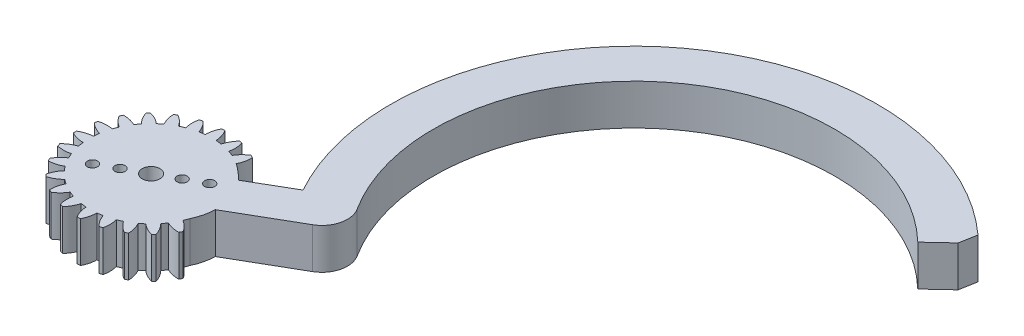
from build123d import *

# Parameters (mm, degrees)
CROQUIS3_R              = 1.75
SALIENTE_EXTRUIR2_DEPTH = 8
CROQUIS4_R              = 1
CORTAR_EXTRUIR1_DEPTH   = 8
CORTAR_EXTRUIR2_DEPTH   = 4


with BuildPart() as part:
    # Croquis3 → Saliente-Extruir2 (new body)
    with BuildSketch(Plane(origin=(0, 0, 0), x_dir=(1, 0, 0), z_dir=(0, 1, 0))):
        with BuildLine():
            Line((87.111019212, 63.804032696), (91.223264764, 67.638763711))
            Line((91.223264764, 67.638763711), (91.815621149, 70.950831381))
            ThreePointArc((91.815621149, 70.950831381), (29.87732987, 72.940785596), (17.735388738, 12.171672472))
            Line((17.735388738, 12.171672472), (9.721894551, 7.515983209))
            ThreePointArc((9.721894551, 7.515983209), (9.056743368, 8.17044576), (8.33477019, 8.76163275))
            ThreePointArc((8.33477019, 8.76163275), (7.527702463, 9.464052948), (6.66170644, 10.092386728))
            ThreePointArc((6.66170644, 10.092386728), (7.120443737, 11.359558341), (7.251125308, 12.700858505))
            ThreePointArc((7.251125308, 12.700858505), (6.978446869, 12.852700273), (6.702590326, 12.9986887))
            ThreePointArc((6.702590326, 12.9986887), (5.648855639, 12.158565486), (4.835962342, 11.083684892))
            ThreePointArc((4.835962342, 11.083684892), (4.333654022, 11.289554703), (3.822612402, 11.472673489))
            ThreePointArc((3.822612402, 11.472673489), (3.937750458, 12.815397225), (3.716825134, 14.144816574))
            ThreePointArc((3.716825134, 14.144816574), (3.414138446, 14.220910086), (3.109896902, 14.290527151))
            ThreePointArc((3.109896902, 14.290527151), (2.349191787, 13.184063868), (1.802512181, 11.957656643))
            ThreePointArc((1.802512181, 11.957656643), (1.264036574, 12.02650465), (0.723013645, 12.071116511))
            ThreePointArc((0.723013645, 12.071116511), (0.486705992, 13.397887968), (-0.07077053, 14.624828769))
            ThreePointArc((-0.07077053, 14.624828769), (-0.382837869, 14.619988378), (-0.694730857, 14.608489793))
            ThreePointArc((-0.694730857, 14.608489793), (-1.187230257, 13.354054404), (-1.353776206, 12.016733855))
            ThreePointArc((-1.353776206, 12.016733855), (-1.891722877, 11.943868181), (-2.425857296, 11.846932892))
            ThreePointArc((-2.425857296, 11.846932892), (-2.997506682, 13.067334786), (-3.8535433, 14.108183052))
            ThreePointArc((-3.8535433, 14.108183052), (-4.153724416, 14.022738622), (-4.452013856, 13.930907997))
            ThreePointArc((-4.452013856, 13.930907997), (-4.603059976, 12.591748233), (-4.417806982, 11.256890513))
            ThreePointArc((-4.417806982, 11.256890513), (-4.918564541, 11.047276833), (-5.409410071, 10.815400374))
            ThreePointArc((-5.409410071, 10.815400374), (-6.27744423, 11.846264333), (-7.373703462, 12.630087975))
            ThreePointArc((-7.373703462, 12.630087975), (-7.641541509, 12.469862404), (-7.905899467, 12.303957843))
            ThreePointArc((-7.905899467, 12.303957843), (-7.705198765, 10.971335229), (-7.180771513, 9.729908686))
            ThreePointArc((-7.180771513, 9.729908686), (-7.610214159, 9.397831825), (-8.02432049, 9.046816193))
            ThreePointArc((-8.02432049, 9.046816193), (-9.129584328, 9.817890543), (-10.391357918, 10.291273275))
            ThreePointArc((-10.391357918, 10.291273275), (-10.608600176, 10.06718567), (-10.821011096, 9.838513296))
            ThreePointArc((-10.821011096, 9.838513296), (-10.282240991, 8.60324386), (-9.454378332, 7.539849661))
            ThreePointArc((-9.454378332, 7.539849661), (-9.783240259, 7.10794011), (-10.092386728, 6.66170644))
            ThreePointArc((-10.092386728, 6.66170644), (-11.359558341, 7.120443737), (-12.700858505, 7.251125308))
            ThreePointArc((-12.700858505, 7.251125308), (-12.852700273, 6.978446869), (-12.9986887, 6.702590326))
            ThreePointArc((-12.9986887, 6.702590326), (-12.158565486, 5.648855639), (-11.083684892, 4.835962342))
            ThreePointArc((-11.083684892, 4.835962342), (-11.289554703, 4.333654022), (-11.472673489, 3.822612402))
            ThreePointArc((-11.472673489, 3.822612402), (-12.815397225, 3.937750458), (-14.144816574, 3.716825134))
            ThreePointArc((-14.144816574, 3.716825134), (-14.220910086, 3.414138446), (-14.290527151, 3.109896902))
            ThreePointArc((-14.290527151, 3.109896902), (-13.206303836, 2.309507242), (-11.957656643, 1.802512181))
            ThreePointArc((-11.957656643, 1.802512181), (-12.02650465, 1.264036574), (-12.071116511, 0.723013645))
            ThreePointArc((-12.071116511, 0.723013645), (-13.397887968, 0.486705992), (-14.624828769, -0.07077053))
            ThreePointArc((-14.624828769, -0.07077053), (-14.619988378, -0.382837869), (-14.608489793, -0.694730857))
            ThreePointArc((-14.608489793, -0.694730857), (-13.354054404, -1.187230257), (-12.016733855, -1.353776206))
            ThreePointArc((-12.016733855, -1.353776206), (-11.943868181, -1.891722877), (-11.846932892, -2.425857296))
            ThreePointArc((-11.846932892, -2.425857296), (-13.067334786, -2.997506682), (-14.108183052, -3.8535433))
            ThreePointArc((-14.108183052, -3.8535433), (-14.022738622, -4.153724416), (-13.930907997, -4.452013856))
            ThreePointArc((-13.930907997, -4.452013856), (-12.591748233, -4.603059976), (-11.256890513, -4.417806982))
            ThreePointArc((-11.256890513, -4.417806982), (-11.047276833, -4.918564541), (-10.815400374, -5.409410071))
            ThreePointArc((-10.815400374, -5.409410071), (-11.846264333, -6.27744423), (-12.630087975, -7.373703462))
            ThreePointArc((-12.630087975, -7.373703462), (-12.469862404, -7.641541509), (-12.303957843, -7.905899467))
            ThreePointArc((-12.303957843, -7.905899467), (-10.971335229, -7.705198765), (-9.729908686, -7.180771513))
            ThreePointArc((-9.729908686, -7.180771513), (-9.397831825, -7.610214159), (-9.046816193, -8.02432049))
            ThreePointArc((-9.046816193, -8.02432049), (-9.817890543, -9.129584328), (-10.291273275, -10.391357918))
            ThreePointArc((-10.291273275, -10.391357918), (-10.06718567, -10.608600176), (-9.838513296, -10.821011096))
            ThreePointArc((-9.838513296, -10.821011096), (-8.60324386, -10.282240991), (-7.539849661, -9.454378332))
            ThreePointArc((-7.539849661, -9.454378332), (-7.10794011, -9.783240259), (-6.66170644, -10.092386728))
            ThreePointArc((-6.66170644, -10.092386728), (-7.120443737, -11.359558341), (-7.251125308, -12.700858505))
            ThreePointArc((-7.251125308, -12.700858505), (-6.978446869, -12.852700273), (-6.702590326, -12.9986887))
            ThreePointArc((-6.702590326, -12.9986887), (-5.648855639, -12.158565486), (-4.835962342, -11.083684892))
            ThreePointArc((-4.835962342, -11.083684892), (-4.333654022, -11.289554703), (-3.822612402, -11.472673489))
            ThreePointArc((-3.822612402, -11.472673489), (-3.937750458, -12.815397225), (-3.716825134, -14.144816574))
            ThreePointArc((-3.716825134, -14.144816574), (-3.414138446, -14.220910086), (-3.109896902, -14.290527151))
            ThreePointArc((-3.109896902, -14.290527151), (-2.309507242, -13.206303836), (-1.802512181, -11.957656643))
            ThreePointArc((-1.802512181, -11.957656643), (-1.264036574, -12.02650465), (-0.723013645, -12.071116511))
            ThreePointArc((-0.723013645, -12.071116511), (-0.486705992, -13.397887968), (0.07077053, -14.624828769))
            ThreePointArc((0.07077053, -14.624828769), (0.382837869, -14.619988378), (0.694730857, -14.608489793))
            ThreePointArc((0.694730857, -14.608489793), (1.187230257, -13.354054404), (1.353776206, -12.016733855))
            ThreePointArc((1.353776206, -12.016733855), (1.891722877, -11.943868181), (2.425857296, -11.846932892))
            ThreePointArc((2.425857296, -11.846932892), (2.997506682, -13.067334786), (3.8535433, -14.108183052))
            ThreePointArc((3.8535433, -14.108183052), (4.153724416, -14.022738622), (4.452013856, -13.930907997))
            ThreePointArc((4.452013856, -13.930907997), (4.603059976, -12.591748233), (4.417806982, -11.256890513))
            ThreePointArc((4.417806982, -11.256890513), (4.918564541, -11.047276833), (5.409410071, -10.815400374))
            ThreePointArc((5.409410071, -10.815400374), (6.27744423, -11.846264333), (7.373703462, -12.630087975))
            ThreePointArc((7.373703462, -12.630087975), (7.641541509, -12.469862404), (7.905899467, -12.303957843))
            ThreePointArc((7.905899467, -12.303957843), (7.705198765, -10.971335229), (7.180771513, -9.729908686))
            ThreePointArc((7.180771513, -9.729908686), (7.610214159, -9.397831825), (8.02432049, -9.046816193))
            ThreePointArc((8.02432049, -9.046816193), (9.129584328, -9.817890543), (10.391357918, -10.291273275))
            Line((10.391357918, -10.291273275), (10.821011096, -9.838513296))
            ThreePointArc((10.821011096, -9.838513296), (10.282240991, -8.60324386), (9.454378332, -7.539849661))
            ThreePointArc((9.454378332, -7.539849661), (9.783240259, -7.10794011), (10.092386728, -6.66170644))
            ThreePointArc((10.092386728, -6.66170644), (11.359558341, -7.120443737), (12.700858505, -7.251125308))
            ThreePointArc((12.700858505, -7.251125308), (12.852700273, -6.978446869), (12.9986887, -6.702590326))
            ThreePointArc((12.9986887, -6.702590326), (12.158565486, -5.648855639), (11.083684892, -4.835962342))
            ThreePointArc((11.083684892, -4.835962342), (11.289554703, -4.333654022), (11.472673489, -3.822612402))
            ThreePointArc((11.472673489, -3.822612402), (12.166604466, -1.858471402), (12.448632794, 0.205469027))
            Line((12.448632794, 0.205469027), (24.597080908, 7.219378816))
            ThreePointArc((24.597080908, 7.219378816), (26.952693775, 10.356600271), (26.318983455, 14.228225469))
            ThreePointArc((26.318983455, 14.228225469), (34.708358258, 66.001642936), (87.111019212, 63.804032696))
        make_face()
        with Locations(Location((0, 0, 0), (0, 0, 270))):
            Circle(CROQUIS3_R, mode=Mode.SUBTRACT)
    extrude(amount=SALIENTE_EXTRUIR2_DEPTH)

    # Croquis4 → Cortar-Extruir1 (cut)
    with BuildSketch(Plane(origin=(0, 8, 0), x_dir=(1, 0, 0), z_dir=(0, 1, 0))):
        with Locations(Location((3.943679518, 2.167346732, 0), (0, 0, 270))):
            Circle(CROQUIS4_R)
        with Locations(Location((-3.943679518, -2.167346732, 0), (0, 0, 270))):
            Circle(CROQUIS4_R)
        with Locations(Location((7.449172424, 4.09387716, 0), (0, 0, 270))):
            Circle(CROQUIS4_R)
        with Locations(Location((-7.449172424, -4.09387716, 0), (0, 0, 270))):
            Circle(CROQUIS4_R)
    extrude(amount=-CORTAR_EXTRUIR1_DEPTH, mode=Mode.SUBTRACT)

    # Croquis5 → Cortar-Extruir2 (cut)
    with BuildSketch(Plane.XZ):
        with BuildLine():
            Line((-5.763458299, 7.161183452), (9.134886548, -1.026570868))
            ThreePointArc((9.134886548, -1.026570868), (10.516478716, -5.779591285), (5.763458299, -7.161183452))
            Line((5.763458299, -7.161183452), (-9.134886548, 1.026570868))
            ThreePointArc((-9.134886548, 1.026570868), (-10.516478716, 5.779591285), (-5.763458299, 7.161183452))
        make_face()
    extrude(amount=-CORTAR_EXTRUIR2_DEPTH, mode=Mode.SUBTRACT)


solid = part.part
